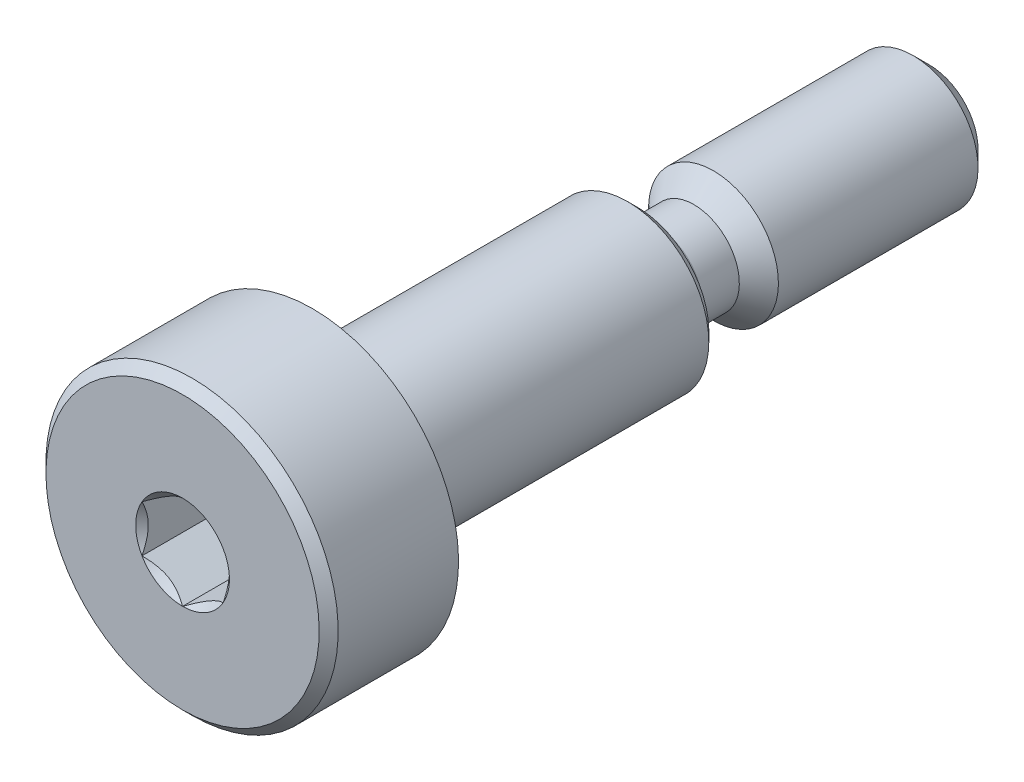
from build123d import *

# Parameters (mm, degrees)
SKETCH12_W         = 1
SKETCH12_H         = 0.6
CHAMFER3_SIZE      = 0.1625
CHAMFER1_SIZE      = 0.5
CHAMFER2_SIZE      = 0.2925
CUT_EXTRUDE2_DEPTH = 2


with BuildPart() as part:
    # Sketch1 → Revolve1 (revolve)
    with BuildSketch(Plane(origin=(0, 0, 0), x_dir=(0, 0, -1), z_dir=(1, 0, 0))):
        Polygon((0, 4.5), (4, 4.5), (4, 2.5), (14, 2.5), (14, 2), (23, 2), (23, 0), (0, 0), align=None)
    revolve(axis=Axis((0, 0, -23), (0, 0, 1)))

    # Sketch12 → Cut-Revolve2 (revolve, cut)
    with BuildSketch(Plane(origin=(0, 0, 0), x_dir=(0, 0, -1), z_dir=(1, 0, 0))):
        with Locations((4.5, 2.2)):
            Rectangle(SKETCH12_W, SKETCH12_H)
    revolve(axis=Axis((0, 0, -23), (0, 0, 1)), mode=Mode.SUBTRACT)

    # Chamfer3
    chamfer3_edges = [part.edges().sort_by_distance(p)[0] for p in [
        (0, -2.5, -5),
        (0, -1.9, -5),
    ]]
    chamfer(chamfer3_edges, length=CHAMFER3_SIZE)

    # Sketch5 → Cut-Revolve1 (revolve, cut)
    with BuildSketch(Plane(origin=(0, 0, 0), x_dir=(0, 0, -1), z_dir=(1, 0, 0))):
        with BuildLine():
            Line((14, 2.5), (16.852, 2.5))
            Line((16.852, 2.5), (15.75, 1.398))
            Line((15.75, 1.398), (14.602, 1.398))
            ThreePointArc((14.602, 1.398), (14.176321718, 1.574321718), (14, 2))
            Line((14, 2), (14, 2.5))
        make_face()
    revolve(axis=Axis((0, 0, -23), (0, 0, 1)), mode=Mode.SUBTRACT)

    # Chamfer1
    chamfer1_edges = [part.edges().sort_by_distance(p)[0] for p in [
        (0, -2, -23),
    ]]
    chamfer(chamfer1_edges, length=CHAMFER1_SIZE)

    # Chamfer2
    chamfer2_edges = [part.edges().sort_by_distance(p)[0] for p in [
        (0, -4.5, 0),
        (0, -2.5, -14),
    ]]
    chamfer(chamfer2_edges, length=CHAMFER2_SIZE)

    # Sketch8 → Cut-Extrude2 (cut)
    with BuildSketch(Plane.XY):
        Polygon((1.25, 0.721687836), (0, 1.443375673), (-1.25, 0.721687836), (-1.25, -0.721687836), (0, -1.443375673), (1.25, -0.721687836), align=None)
    extrude(amount=-CUT_EXTRUDE2_DEPTH, mode=Mode.SUBTRACT)

    # Cut-Extrude4 cone 1 section (through the dimple's axis) → Cut-Extrude4 (revolve, cut)
    with BuildSketch(Plane(origin=(0, 0, 0), x_dir=(0, -1, 0), z_dir=(1, 0, 0))):
        Polygon((0, 0), (1.443375673, 0), (0, 1.443375673), align=None)
    revolve(axis=Axis((0, 0, 0), (0, 0, -1)), mode=Mode.SUBTRACT)


solid = part.part
